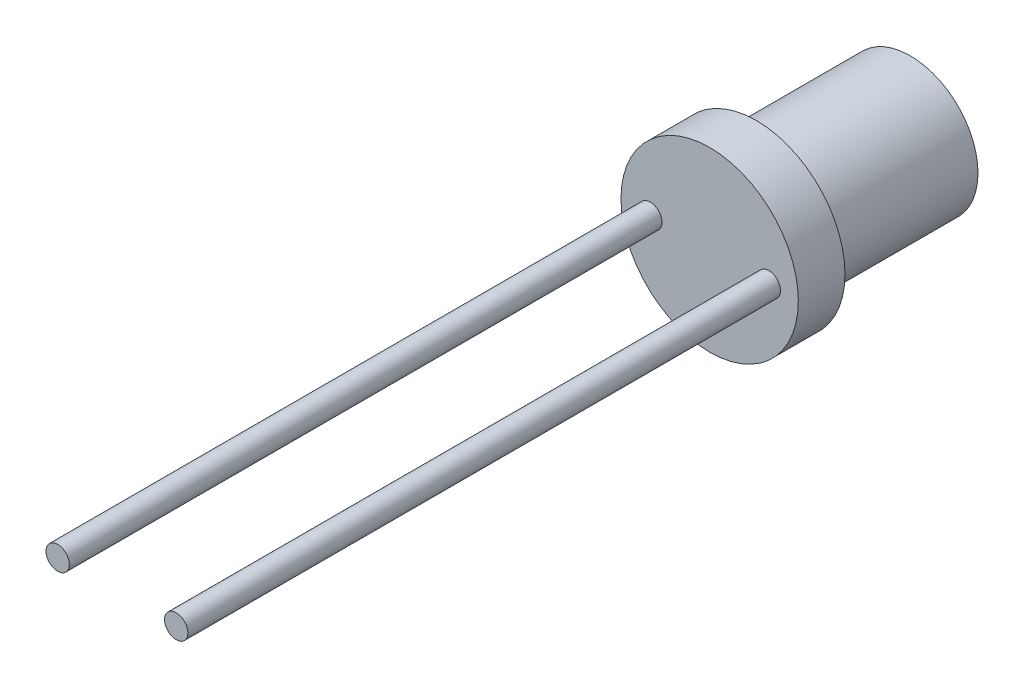
from build123d import *

# Parameters (mm, degrees)
SKETCH_1_R      = 1.45
EXTRUDE_1_DEPTH = 3.3
SKETCH_2_R      = 1.9
EXTRUDE_2_DEPTH = 1
SKETCH_3_R      = 0.25
EXTRUDE_3_DEPTH = 12.7


with BuildPart() as part:
    # 草图1 → 拉伸1 (new body)
    with BuildSketch(Plane.XY):
        Circle(SKETCH_1_R)
    extrude(amount=EXTRUDE_1_DEPTH)

    # 草图2 → 拉伸2 (add)
    with BuildSketch(Plane.XY.offset(3.3)):
        Circle(SKETCH_2_R)
    extrude(amount=EXTRUDE_2_DEPTH)

    # 草图3 → 拉伸3 (add)
    with BuildSketch(Plane.XY.offset(4.3)):
        with Locations((-1.27, 0)):
            Circle(SKETCH_3_R)
        with Locations(Location((1.27, 0, 0), (0, 0, 180))):
            Circle(SKETCH_3_R)
    extrude(amount=EXTRUDE_3_DEPTH)


solid = part.part
